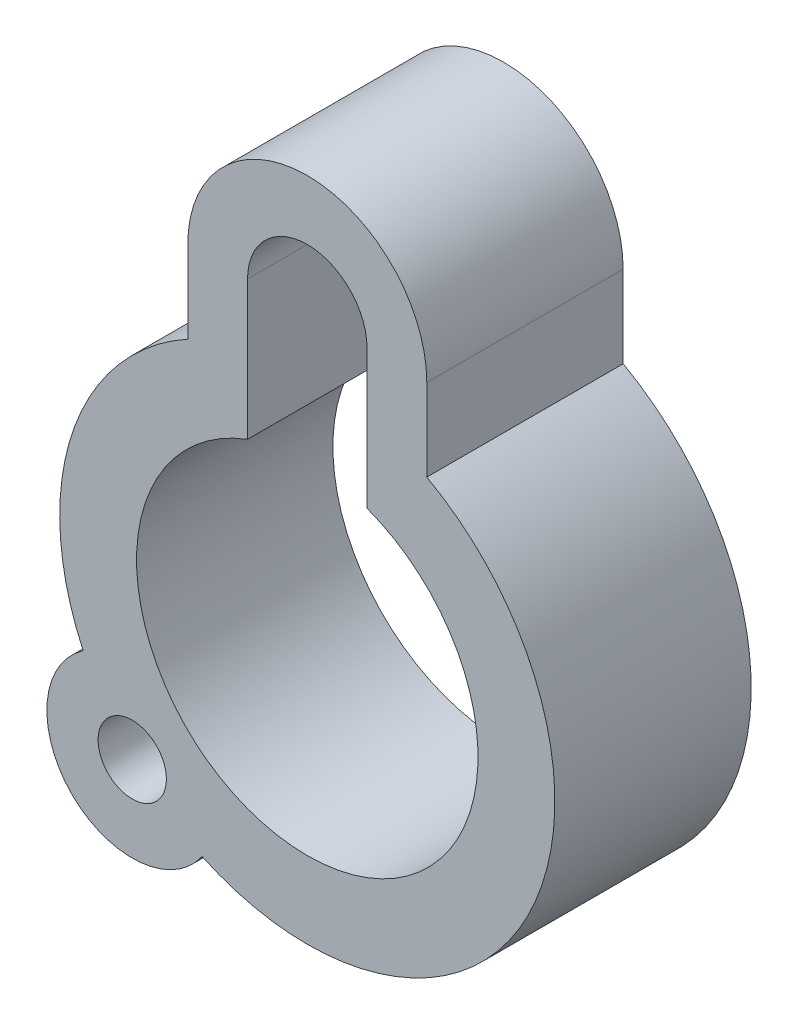
from build123d import *

# Parameters (mm, degrees)
SKETCH_1_R      = 4
EXTRUDE_1_DEPTH = 23


with BuildPart() as part:
    # Эскиз1 → Бобышка-Вытянуть1 (new body)
    with BuildSketch(Plane.XY):
        with BuildLine():
            ThreePointArc((-14, 25.396850198), (-27.581369596, 8.959243897), (-26.252122851, -12.321771212))
            ThreePointArc((-26.252122851, -12.321771212), (-27.577164466, -27.577164466), (-12.321771212, -26.252122851))
            ThreePointArc((-12.321771212, -26.252122851), (25.83811559, -13.167831361), (14, 25.396850198))
            Line((14, 25.396850198), (14, 35))
            ThreePointArc((14, 35), (0, 49), (-14, 35))
            Line((-14, 35), (-14, 25.396850198))
        make_face()
        with BuildLine():
            Line((-7, 18.734993995), (-7, 35))
            ThreePointArc((-7, 35), (0, 42), (7, 35))
            Line((7, 35), (7, 18.734993995))
            ThreePointArc((7, 18.734993995), (0, -20), (-7, 18.734993995))
        make_face(mode=Mode.SUBTRACT)
        with Locations((-20.506096654, -20.506096654)):
            Circle(SKETCH_1_R, mode=Mode.SUBTRACT)
    extrude(amount=EXTRUDE_1_DEPTH)


solid = part.part
